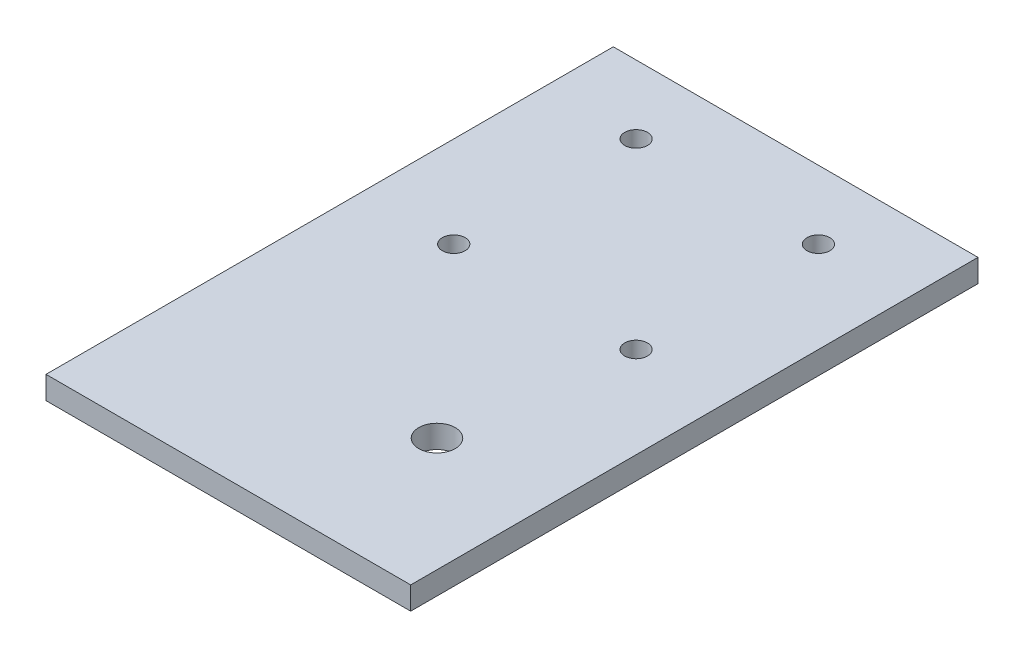
from build123d import *

# Parameters (mm, degrees)
SKETCH1_R           = 2.5
SKETCH1_R_2         = 4
BOSS_EXTRUDE1_DEPTH = 5


with BuildPart() as part:
    # Sketch1 → Boss-Extrude1 (new body)
    with BuildSketch(Plane(origin=(0, 0, 0), x_dir=(1, 0, 0), z_dir=(0, 1, 0))):
        Polygon((40, 2.94599018), (120, 2.94599018), (120, -67.05400982), (120, -121.498685507), (40, -121.498685507), (40, -67.05400982), align=None)
        with Locations(Location((60, -12.05400982, 0), (0, 0, 270))):
            Circle(SKETCH1_R, mode=Mode.SUBTRACT)
        with Locations(Location((60, -52.05400982, 0), (0, 0, 90))):
            Circle(SKETCH1_R, mode=Mode.SUBTRACT)
        with Locations(Location((100, -52.05400982, 0), (0, 0, 270))):
            Circle(SKETCH1_R, mode=Mode.SUBTRACT)
        with Locations(Location((100, -12.05400982, 0), (0, 0, 90))):
            Circle(SKETCH1_R, mode=Mode.SUBTRACT)
        with Locations(Location((95, -90.734036345, 0), (0, 0, 270))):
            Circle(SKETCH1_R_2, mode=Mode.SUBTRACT)
    extrude(amount=BOSS_EXTRUDE1_DEPTH)


solid = part.part
